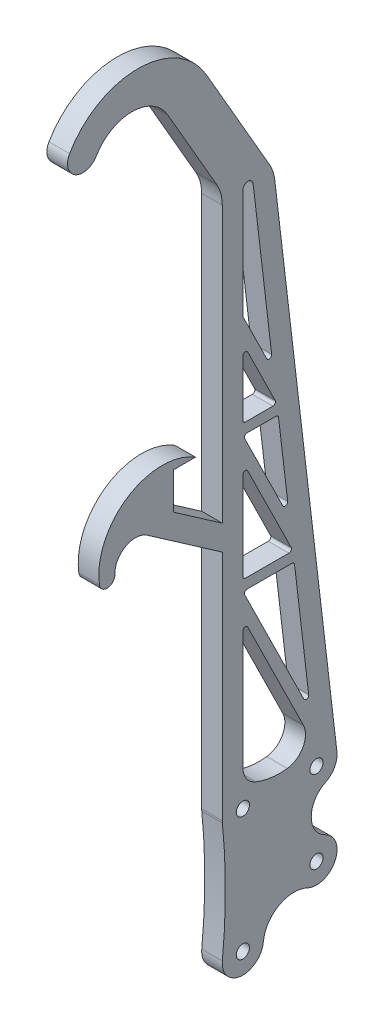
from build123d import *

# Parameters (mm, degrees)
BOSS_EXTRUDE1_DEPTH = 3.175
SKETCH2_R           = 2.032
CUT_EXTRUDE1_DEPTH  = 242.929632893
FILLET1_R           = 12.7
FILLET2_R           = 0.79375
FILLET3_R           = 6.35
BOSS_EXTRUDE2_DEPTH = 6.35
CUT_EXTRUDE2_DEPTH  = 242.929633019


with BuildPart() as part:
    # Sketch1 → Boss-Extrude1 (new, symmetric)
    with BuildSketch(Plane(origin=(0, 0, 0), x_dir=(0, 0, -1), z_dir=(1, 0, 0))):
        with BuildLine():
            Line((-17.7, 19.05), (-17.7, 183.35625))
            ThreePointArc((-17.7, 183.35625), (-18.132742006, 186.643251873), (-19.401477372, 189.70625))
            Line((-19.401477372, 189.70625), (-34.524445986, 215.9))
            ThreePointArc((-34.524445986, 215.9), (-45.522968614, 222.25), (-56.521491242, 215.9))
            ThreePointArc((-56.521491242, 215.9), (-63.027187227, 214.156804014), (-64.770383213, 220.6625))
            ThreePointArc((-64.770383213, 220.6625), (-43.689881509, 232.833333333), (-22.609379805, 220.6625))
            Line((-22.609379805, 220.6625), (-1.825, 184.662898174))
            Line((-1.825, 184.662898174), (17.656128594, 19.795145732))
            ThreePointArc((17.656128594, 19.795145732), (16.917823934, 15.996831704), (14.112111824, 13.332199875))
            ThreePointArc((14.112111824, 13.332199875), (9.73081975, 6.35), (14.112111824, -0.632199875))
            ThreePointArc((14.112111824, -0.632199875), (17.067800125, -9.112111824), (8.587888176, -12.067800125))
            ThreePointArc((8.587888176, -12.067800125), (-0.205881062, -12.332007866), (-5.032111824, -19.687800125))
            ThreePointArc((-5.032111824, -19.687800125), (-11.987800125, -25.367888176), (-17.667888176, -18.412199875))
            ThreePointArc((-17.667888176, -18.412199875), (-16.740874674, 0), (-17.667888176, 18.412199875))
            ThreePointArc((-17.667888176, 18.412199875), (-17.691966963, 18.730696003), (-17.7, 19.05))
        make_face()
        with BuildLine():
            Line((-11.35, 25.4), (-11.35, 69.85))
            Line((-11.35, 69.85), (10.604854268, 25.356128594))
            ThreePointArc((10.604854268, 25.356128594), (9.571869946, 25.145962066), (8.587888176, 24.767800125))
            ThreePointArc((8.587888176, 24.767800125), (0, 22.802180275), (-8.587888176, 24.767800125))
            ThreePointArc((-8.587888176, 24.767800125), (-9.933230928, 25.239932584), (-11.35, 25.4))
        make_face(mode=Mode.SUBTRACT)
        Polygon((9.490062912, 34.790548391), (-11.35, 77.025175321), (4.499528462, 77.025175321), align=None, mode=Mode.SUBTRACT)
        Polygon((4.124363626, 80.200175321), (-11.35, 80.200175321), (-11.35, 111.560636058), align=None, mode=Mode.SUBTRACT)
        Polygon((3.00957227, 89.634595118), (-11.35, 118.735811379), (-0.429090099, 118.735811379), align=None, mode=Mode.SUBTRACT)
        Polygon((-0.804254935, 121.910811379), (-11.35, 121.910811379), (-11.35, 143.282896982), align=None, mode=Mode.SUBTRACT)
        with BuildLine():
            Line((-8.185967852, 184.381854159), (-1.919046291, 131.345231176))
            Line((-1.919046291, 131.345231176), (-11.35, 150.458072303))
            Line((-11.35, 150.458072303), (-11.35, 184.195567726))
            ThreePointArc((-11.35, 184.195567726), (-9.855804513, 185.780323391), (-8.185967852, 184.381854159))
        make_face(mode=Mode.SUBTRACT)
    extrude(amount=BOSS_EXTRUDE1_DEPTH, both=True)

    # Sketch2 → Cut-Extrude1 (cut, through all)
    with BuildSketch(Plane(origin=(3.175, 0, 0), x_dir=(0, 0, -1), z_dir=(1, 0, 0))):
        with Locations((11.35, -6.35)):
            Circle(SKETCH2_R)
        with Locations((11.35, 19.05)):
            Circle(SKETCH2_R)
        with Locations((-11.35, 19.05)):
            Circle(SKETCH2_R)
        with Locations((-11.35, -19.05)):
            Circle(SKETCH2_R)
    extrude(amount=-CUT_EXTRUDE1_DEPTH, mode=Mode.SUBTRACT)

    # Fillet1
    fillet1_edges = [part.edges().sort_by_distance(p)[0] for p in [
        (0, 184.662898174, 1.825),
    ]]
    fillet(fillet1_edges, radius=FILLET1_R)

    # Fillet2
    fillet2_edges = [part.edges().sort_by_distance(p)[0] for p in [
        (0, 69.85, 11.35),
        (0, 34.790548391, -9.490062912),
        (0, 77.025175321, -4.499528462),
        (0, 77.025175321, 11.35),
        (0, 80.200175321, -4.124363626),
        (0, 111.560636058, 11.35),
        (0, 80.200175321, 11.35),
        (0, 89.634595118, -3.00957227),
        (0, 118.735811379, 0.429090099),
        (0, 118.735811379, 11.35),
        (0, 121.910811379, 0.804254935),
        (0, 143.282896982, 11.35),
        (0, 121.910811379, 11.35),
        (0, 150.458072303, 11.35),
        (0, 131.345231176, 1.919046291),
    ]]
    fillet(fillet2_edges, radius=FILLET2_R)

    # Fillet3
    fillet3_edges = [part.edges().sort_by_distance(p)[0] for p in [
        (0, 25.4, 11.35),
        (0, 25.356128594, -10.604854268),
    ]]
    fillet(fillet3_edges, radius=FILLET3_R)

    # Sketch3 → Boss-Extrude2 (add)
    with BuildSketch(Plane(origin=(3.175, 0, 0), x_dir=(0, 0, -1), z_dir=(1, 0, 0))):
        with BuildLine():
            Line((-17.7, 113.663160513), (-17.7, 90.742041294))
            Line((-17.7, 90.742041294), (-40.826076924, 106.814372593))
            ThreePointArc((-40.826076924, 106.814372593), (-47.50636364, 107.166070544), (-50.794697112, 101.340541809))
            ThreePointArc((-50.794697112, 101.340541809), (-52.976424691, 98.851804162), (-55.570143469, 100.907618649))
            ThreePointArc((-55.570143469, 100.907618649), (-45.805288512, 120.644406163), (-23.869094131, 118.721764812))
            Line((-23.869094131, 118.721764812), (-17.7, 113.663160513))
        make_face()
    extrude(amount=-BOSS_EXTRUDE2_DEPTH)

    # Sketch4 → Cut-Extrude2 (cut, through all)
    with BuildSketch(Plane(origin=(3.175, 0, 0), x_dir=(0, 0, -1), z_dir=(1, 0, 0))):
        Polygon((-17.7, 98.474994642), (-32.722386581, 108.91536353), (-32.722386581, 120.21942978), (-17.7, 120.21942978), align=None)
    extrude(amount=-CUT_EXTRUDE2_DEPTH, mode=Mode.SUBTRACT)


solid = part.part
